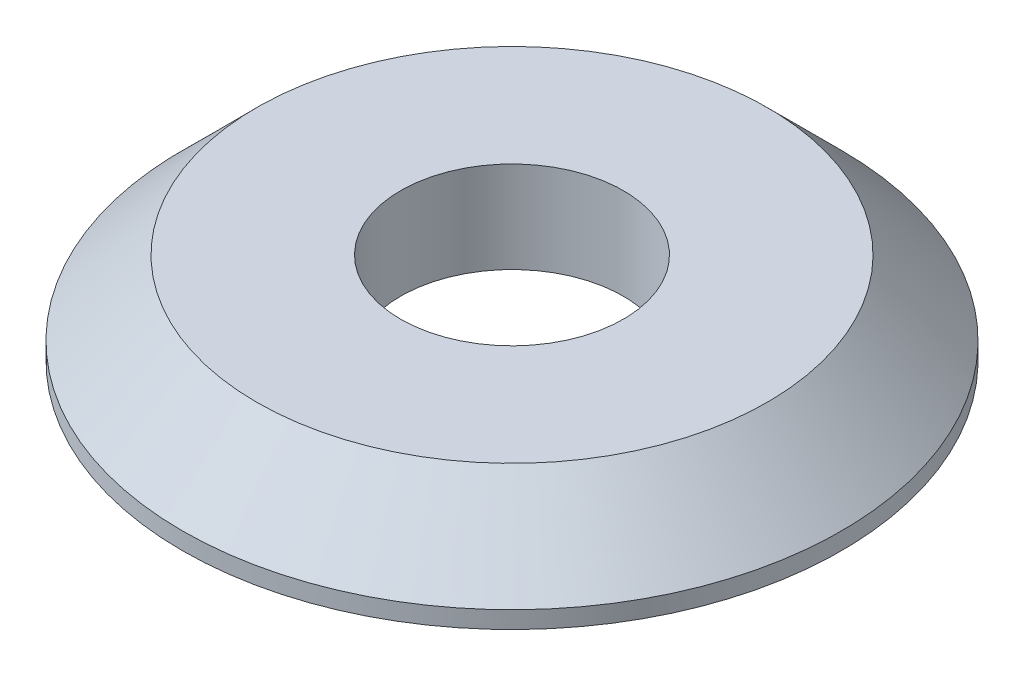
from build123d import *

# Parameters (mm, degrees)
SKETCH1_R           = 9.017
SKETCH1_R_2         = 3.048
BOSS_EXTRUDE1_DEPTH = 1.25095
CHAMFER1_SIZE       = 2.032


with BuildPart() as part:
    # Sketch1 → Boss-Extrude1 (new, symmetric)
    with BuildSketch(Plane(origin=(0, 0, 0), x_dir=(1, 0, 0), z_dir=(0, 1, 0))):
        with Locations(Location((0, 0, 0), (0, 0, 270))):
            Circle(SKETCH1_R)
        with Locations(Location((0, 0, 0), (0, 0, 270))):
            Circle(SKETCH1_R_2, mode=Mode.SUBTRACT)
    extrude(amount=BOSS_EXTRUDE1_DEPTH, both=True)

    # Chamfer1
    chamfer1_edges = [part.edges().sort_by_distance(p)[0] for p in [
        (0, 1.25095, -9.017),
    ]]
    chamfer(chamfer1_edges, length=CHAMFER1_SIZE)


solid = part.part
